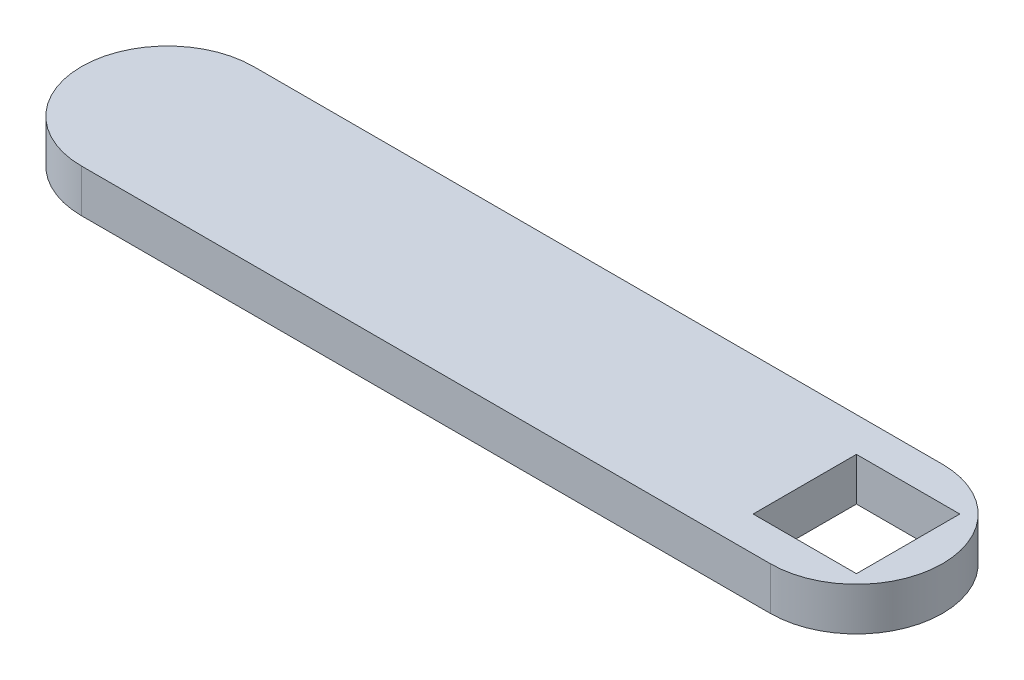
from build123d import *

# Parameters (mm, degrees)
EXTRUDE_1_DEPTH     = 25
SKETCH_2_W          = 60
SKETCH_2_H          = 60
CUT_EXTRUDE_1_DEPTH = 25


with BuildPart() as part:
    # 草图1 → 凸台-拉伸1 (new body)
    with BuildSketch(Plane(origin=(0, 0, 0), x_dir=(1, 0, 0), z_dir=(0, 1, 0))):
        with BuildLine():
            Line((0, 50), (400, 50))
            ThreePointArc((400, 50), (450, 0), (400, -50))
            Line((400, -50), (0, -50))
            ThreePointArc((0, -50), (-50, 0), (0, 50))
        make_face()
    extrude(amount=EXTRUDE_1_DEPTH)

    # 草图2 → 切除-拉伸1 (cut)
    with BuildSketch(Plane(origin=(0, 25, 0), x_dir=(1, 0, 0), z_dir=(0, 1, 0))):
        with Locations((400, 0)):
            Rectangle(SKETCH_2_W, SKETCH_2_H)
    extrude(amount=-CUT_EXTRUDE_1_DEPTH, mode=Mode.SUBTRACT)


solid = part.part
